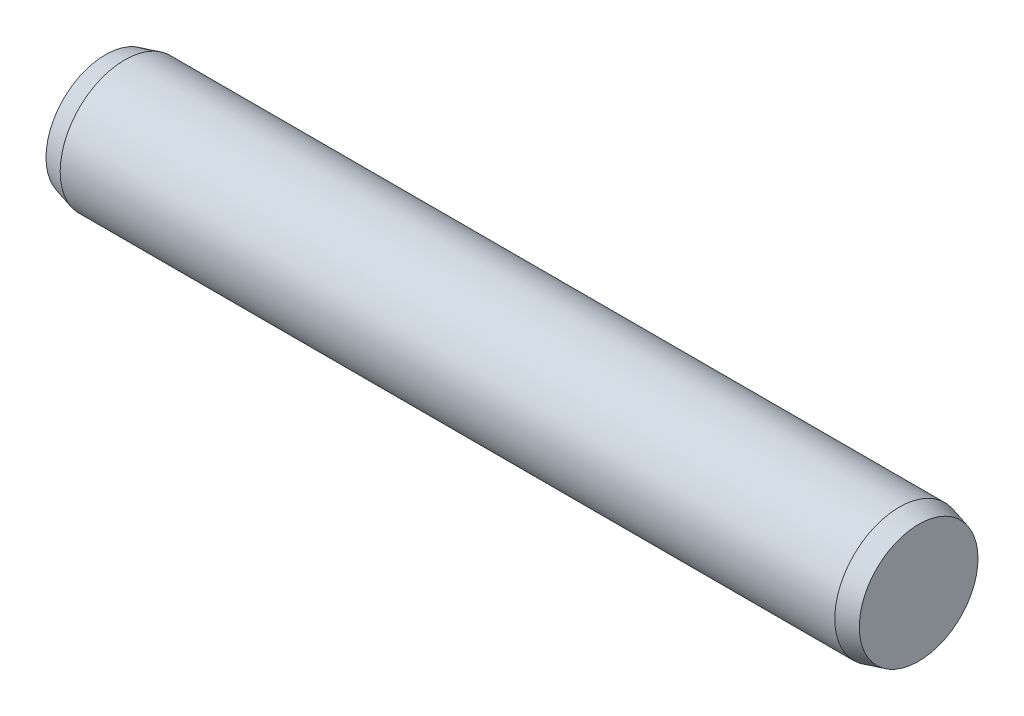
from build123d import *

# Parameters (mm, degrees)
EXTRUDE1_DEPTH      = 9
EXTRUDE1_DEPTH_BACK = 9
SKETCH2_R           = 1.5
SKETCH3_R           = 1.5
EXTRUDE2_DEPTH      = 0.45
EXTRUDE2_TAPER      = 15
SKETCH4_R           = 1.5
EXTRUDE3_DEPTH      = 0.45
EXTRUDE3_TAPER      = 15


with BuildPart() as part:
    # Sketch2 → Extrude1 (new, two sides: drawn at the far end of the back side and taken through both)
    with BuildSketch(Plane(origin=(0, 0, 0), x_dir=(0, 0, -1), z_dir=(1, 0, 0)).offset(-EXTRUDE1_DEPTH_BACK)):
        Circle(SKETCH2_R)
    extrude(amount=EXTRUDE1_DEPTH + EXTRUDE1_DEPTH_BACK)

    # Sketch3 → Extrude2 (add)
    with BuildSketch(Plane(origin=(9, 0, 0), x_dir=(0, 0, -1), z_dir=(1, 0, 0))):
        Circle(SKETCH3_R)
    extrude(amount=EXTRUDE2_DEPTH, taper=EXTRUDE2_TAPER)

    # Sketch4 → Extrude3 (add)
    with BuildSketch(Plane.ZY.offset(9)):
        with Locations(Location((0, 0, 0), (0, 0, 180))):
            Circle(SKETCH4_R)
    extrude(amount=EXTRUDE3_DEPTH, taper=EXTRUDE3_TAPER)


solid = part.part
